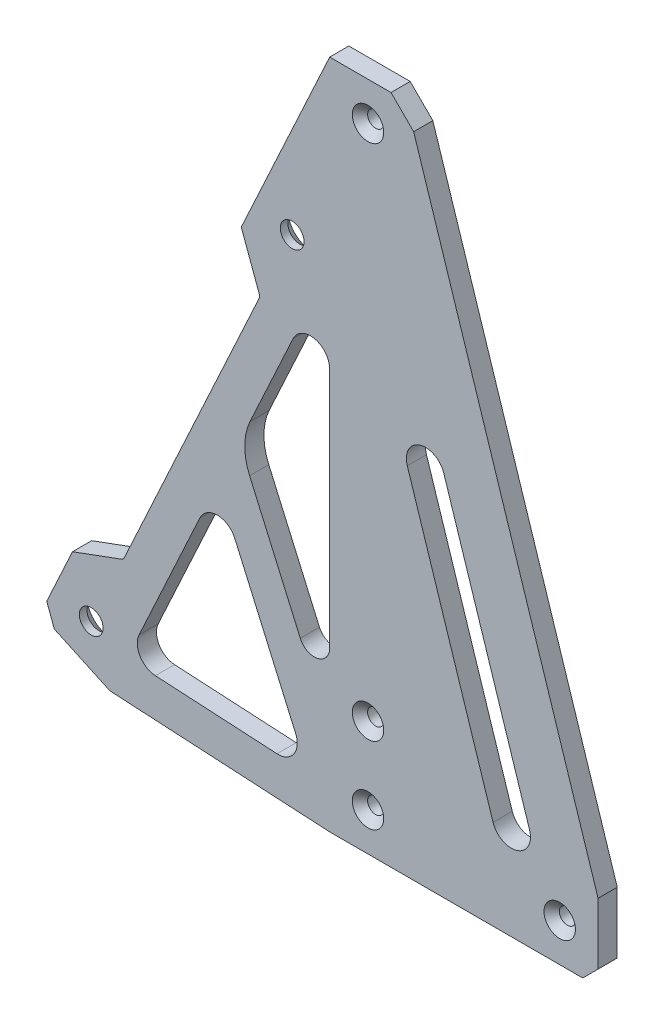
from build123d import *
from OCP.BRepFilletAPI import BRepFilletAPI_MakeChamfer

# Parameters (mm, degrees)
SKETCH_1_R          = 2.1
EXTRUDE_1_DEPTH     = 2.5
CUT_EXTRUDE_1_DEPTH = 95.372930441
EXTRUDE_2_DEPTH     = 5
CUT_EXTRUDE_2_DEPTH = 142.00635371
FILLET_1_R          = 5
FILLET_2_R          = 4
FILLET_3_R          = 15
CHAMFER_1_SIZE      = 4
CHAMFER_1_SIZE2     = 6.20437999
CHAMFER_2_SIZE      = 2
SKETCH_6_R          = 3.1
CUT_EXTRUDE_3_DEPTH = 140.696602049
CUT_EXTRUDE_4_DEPTH = 140.696602049
CHAMFER_3_SIZE      = 3
FILLET_4_R          = 1


with BuildPart() as part:
    # 草图1 → 凸台-拉伸1 (new, symmetric)
    with BuildSketch(Plane.XY):
        Polygon((-35, 87.5), (-35, -87.5), (35, -87.5), (35, -67.5), (-15, 87.5), align=None)
        with Locations((-25, -77.5)):
            Circle(SKETCH_1_R, mode=Mode.SUBTRACT)
        with Locations((25, -77.5)):
            Circle(SKETCH_1_R, mode=Mode.SUBTRACT)
        with Locations((-25, 77.5)):
            Circle(SKETCH_1_R, mode=Mode.SUBTRACT)
        with Locations((-25, -57.5)):
            Circle(SKETCH_1_R, mode=Mode.SUBTRACT)
    extrude(amount=EXTRUDE_1_DEPTH, both=True)

    # 草图2 → 切除-拉伸1 (cut, through all)
    with BuildSketch(Plane(origin=(0, 0, -2.5), x_dir=(-1, 0, 0), z_dir=(0, 0, -1))):
        with BuildLine():
            Line((-17.130804412, -60.9649861), (5.241456911, 8.389024))
            ThreePointArc((5.241456911, 8.389024), (11.5350139, 11.612553189), (14.758543089, 5.318996201))
            Line((14.758543089, 5.318996201), (-7.613718234, -64.0350139))
            ThreePointArc((-7.613718234, -64.0350139), (-13.907275222, -67.258543089), (-17.130804412, -60.9649861))
        make_face()
    extrude(amount=-CUT_EXTRUDE_1_DEPTH, mode=Mode.SUBTRACT)

    # 草图3 → 凸台-拉伸2 (add)
    with BuildSketch(Plane(origin=(0, 0, -2.5), x_dir=(-1, 0, 0), z_dir=(0, 0, -1))):
        Polygon((35, -87.5), (92.302946454, -84.303295451), (110.460589291, -75.918785529), (35, 87.5), align=None)
    extrude(amount=-EXTRUDE_2_DEPTH)

    # 草图5 → 切除-拉伸2 (cut, through all)
    with BuildSketch(Plane(origin=(0, 0, -2.5), x_dir=(-1, 0, 0), z_dir=(0, 0, -1))):
        Polygon((35, 39.792977913), (58.598142626, -11.311576727), (35, -65.049025296), align=None)
        Polygon((87.794289034, -74.539267276), (40.598003783, -77.172161204), (64.196146409, -23.434712635), align=None)
    extrude(amount=-CUT_EXTRUDE_2_DEPTH, mode=Mode.SUBTRACT)

    # 圆角1
    fillet_1_edges = [part.edges().sort_by_distance(p)[0] for p in [
        (-64.196146409, -23.434712635, 0),
        (-87.794289034, -74.539267276, 0),
        (-40.598003783, -77.172161204, 0),
        (-35, 39.792977913, 0),
    ]]
    fillet(fillet_1_edges, radius=FILLET_1_R)

    # 圆角2
    fillet_2_edges = [part.edges().sort_by_distance(p)[0] for p in [
        (-35, -65.049025296, 0),
    ]]
    fillet(fillet_2_edges, radius=FILLET_2_R)

    # 圆角3
    fillet_3_edges = [part.edges().sort_by_distance(p)[0] for p in [
        (-58.598142626, -11.311576727, 0),
    ]]
    fillet(fillet_3_edges, radius=FILLET_3_R)

    # 倒角1: one chamfer whose edges measure the first distance from different faces: ONE call of the kernel's chamfer builder (chamfer() names one face for all edges)
    chamfer_1_edges_1 = [part.edges().sort_by_distance(p)[0] for p in [
        (-110.460589291, -75.918785529, 0),
        (35, -87.5, 0),
    ]]
    chamfer_1_edges_2 = [part.edges().sort_by_distance(p)[0] for p in [
        (-15, 87.5, 0),
    ]]
    chamfer_1_side_2 = [part.faces().sort_by_distance(p)[0] for p in [
        (-25, 87.5, 0),
    ]]
    chamfer_1 = BRepFilletAPI_MakeChamfer(part.part.solid().wrapped)
    for e in chamfer_1_edges_1:
        chamfer_1.Add(CHAMFER_1_SIZE, e.wrapped)
    for e in chamfer_1_edges_2:
        chamfer_1.Add(CHAMFER_1_SIZE, CHAMFER_1_SIZE2, e.wrapped, chamfer_1_side_2[0].wrapped)  # the first distance lies on this face
    add(Compound.cast(chamfer_1.Shape()), mode=Mode.REPLACE)

    # 倒角2
    chamfer_2_edges = [part.edges().sort_by_distance(p)[0] for p in [
        (22.9, -77.5, 2.5),
        (-27.1, -77.5, 2.5),
        (-27.1, 77.5, 2.5),
        (-27.1, -57.5, 2.5),
    ]]
    chamfer(chamfer_2_edges, length=CHAMFER_2_SIZE)

    # 草图6 → 切除-拉伸3 (cut, through all)
    with BuildSketch(Plane(origin=(0, 0, -2.5), x_dir=(-1, 0, 0), z_dir=(0, 0, -1))):
        with Locations((97.189512912, -71.032219072)):
            Circle(SKETCH_6_R)
        with Locations((44.786325904, 42.453048657)):
            Circle(SKETCH_6_R)
    extrude(amount=-CUT_EXTRUDE_3_DEPTH, mode=Mode.SUBTRACT)

    # 草图7 → 切除-拉伸4 (cut, through all)
    with BuildSketch(Plane.XY.offset(2.5)):
        Polygon((-58.057402283, 37.566482199), (-53.170835826, 24.29540582), (-88.805002991, -52.874576235), (-102.07607937, -57.761142693), align=None)
    extrude(amount=-CUT_EXTRUDE_4_DEPTH, mode=Mode.SUBTRACT)

    # 倒角3
    chamfer_3_edges = [part.edges().sort_by_distance(p)[0] for p in [
        (-94.089512912, -71.032219072, -2.5),
        (-41.686325904, 42.453048657, -2.5),
    ]]
    chamfer(chamfer_3_edges, length=CHAMFER_3_SIZE)

    # 圆角4
    fillet_4_edges = [part.edges().sort_by_distance(p)[0] for p in [
        (-53.170835826, 24.29540582, 0),
        (-88.805002991, -52.874576235, 0),
    ]]
    fillet(fillet_4_edges, radius=FILLET_4_R)


solid = part.part
